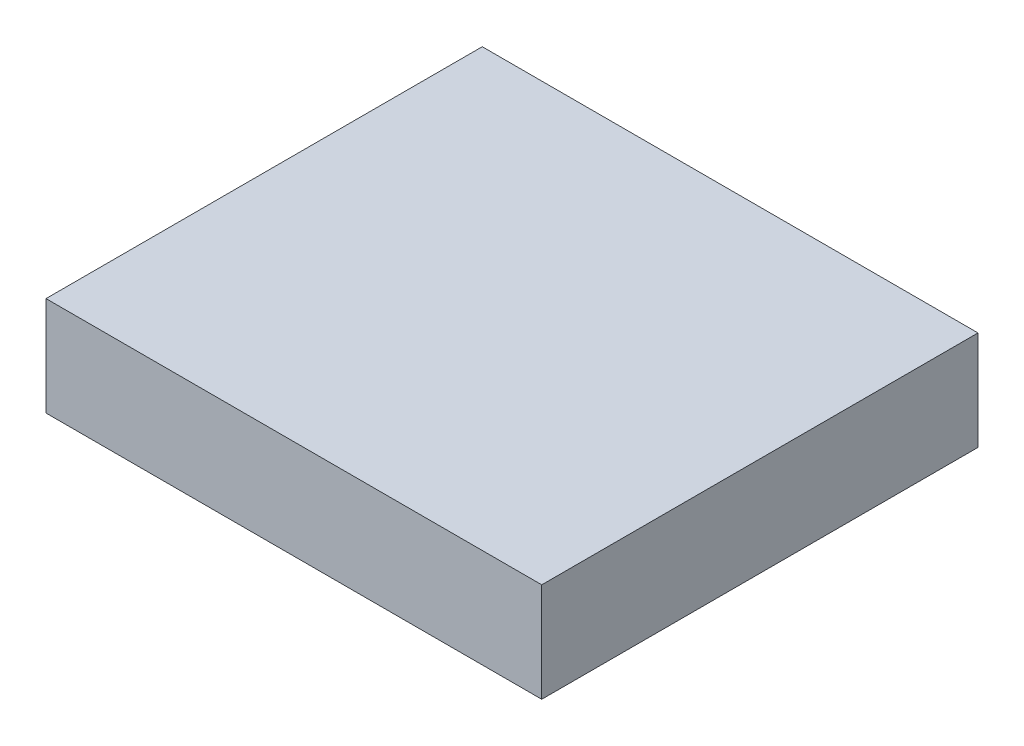
from build123d import *

# Parameters (mm, degrees)
SKETCH1_W           = 5
SKETCH1_H           = 4.4
BOSS_EXTRUDE1_DEPTH = 1


with BuildPart() as part:
    # Sketch1 → Boss-Extrude1 (new body)
    with BuildSketch(Plane(origin=(0, 0, 0), x_dir=(1, 0, 0), z_dir=(0, 1, 0))):
        with Locations((2.5, -2.2)):
            Rectangle(SKETCH1_W, SKETCH1_H)
    extrude(amount=BOSS_EXTRUDE1_DEPTH)


solid = part.part
